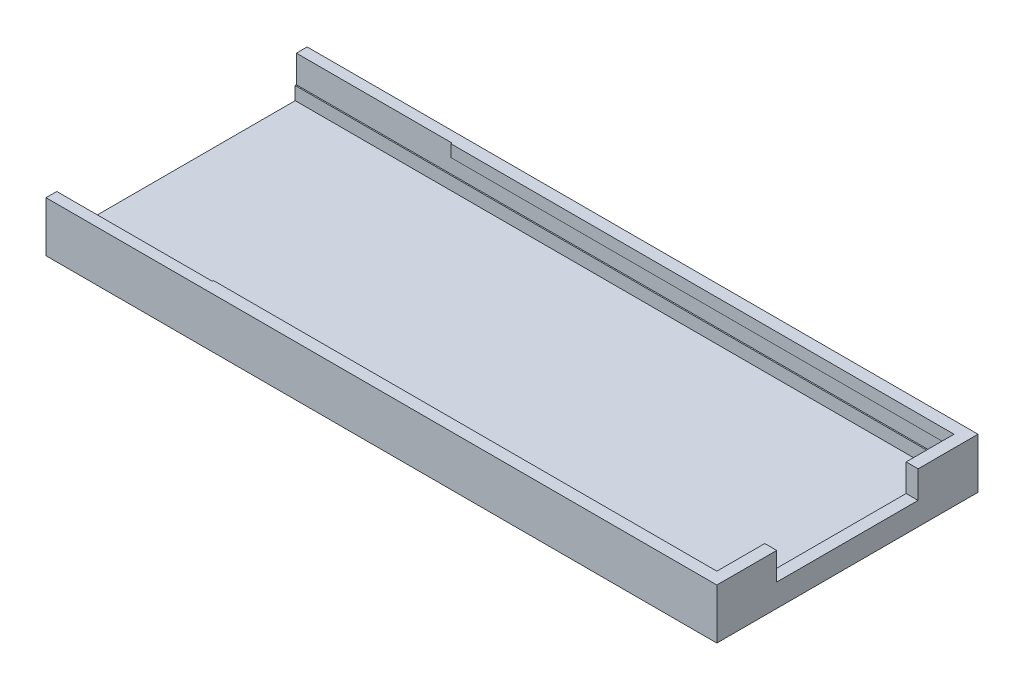
from build123d import *

# Parameters (mm, degrees)
BOSS_EXTRUDE1_DEPTH = 42
BOSS_EXTRUDE2_DEPTH = 1
BOSS_EXTRUDE3_DEPTH = 13


with BuildPart() as part:
    # Sketch1 → Boss-Extrude1 (new body)
    with BuildSketch(Plane(origin=(0, 0, 0), x_dir=(0, 0, -1), z_dir=(1, 0, 0))):
        Polygon((0, 4.2), (0, 0), (10.9, 0), (10.9, 0.81375), (1, 0.81375), (1, 1.91375), (0.9, 1.91375), (0.9, 3.2), (1, 3.2), (1, 4.2), align=None)
        Polygon((10.9, 0.81375), (10.9, 0), (21.8, 0), (21.8, 4.2), (20.8, 4.2), (20.8, 3.2), (20.9, 3.2), (20.9, 1.91375), (20.8, 1.91375), (20.8, 0.81375), align=None)
    extrude(amount=BOSS_EXTRUDE1_DEPTH)

    # Sketch2 → Boss-Extrude2 (add)
    with BuildSketch(Plane(origin=(42, 0, 0), x_dir=(0, 0, -1), z_dir=(1, 0, 0))):
        Polygon((0, 0), (21.8, 0), (21.8, 4.2), (16.8, 4.2), (16.8, 1.91375), (5, 1.91375), (5, 4.2), (0, 4.2), align=None)
    extrude(amount=BOSS_EXTRUDE2_DEPTH)

    # Sketch3 → Boss-Extrude3 (add)
    with BuildSketch(Plane.ZY):
        Polygon((-21.8, 4.2), (-21.8, 0), (0, 0), (0, 4.2), (-0.9, 4.2), (-0.9, 1.91375), (-1, 1.91375), (-1, 0.81375), (-20.8, 0.81375), (-20.8, 1.91375), (-20.9, 1.91375), (-20.9, 4.2), align=None)
    extrude(amount=BOSS_EXTRUDE3_DEPTH)


solid = part.part
